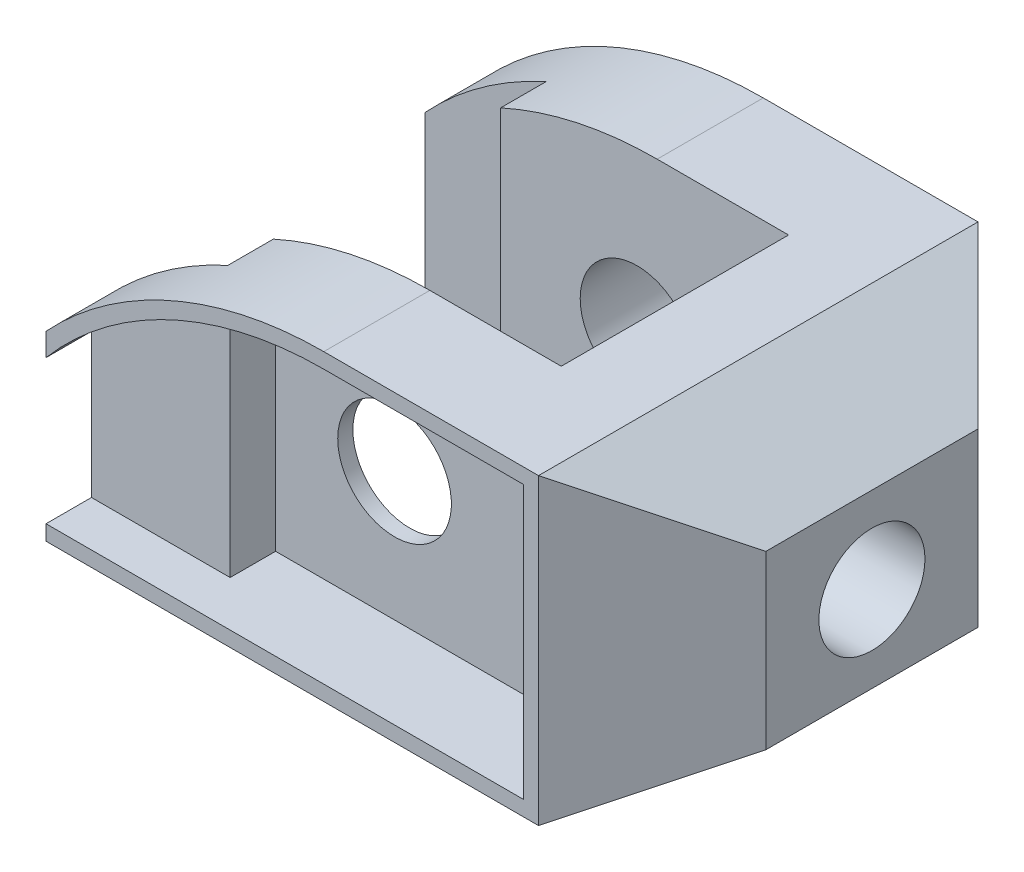
from build123d import *

# Parameters (mm, degrees)
SKETCH1_R           = 7.5
BOSS_EXTRUDE1_DEPTH = 29
CUT_EXTRUDE1_DEPTH  = 72
CUT_EXTRUDE2_DEPTH  = 72
SKETCH4_R           = 7
CUT_EXTRUDE3_DEPTH  = 72
CUT_EXTRUDE11_DEPTH = 12
CUT_EXTRUDE12_DEPTH = 6


with BuildPart() as part:
    # Sketch1 → Boss-Extrude1 (new, symmetric)
    with BuildSketch(Plane.XY):
        with BuildLine():
            Line((0, 0), (65, 0))
            Line((65, 0), (80, 8.660254038))
            Line((80, 8.660254038), (80, 31.339745962))
            Line((80, 31.339745962), (65, 40))
            Line((65, 40), (36.66060556, 40))
            ThreePointArc((36.66060556, 40), (16.66060556, 35.82575695), (0, 24))
            Line((0, 24), (0, 0))
        make_face()
        with Locations(Location((34, 19, 0), (0, 0, 180))):
            Circle(SKETCH1_R, mode=Mode.SUBTRACT)
    extrude(amount=BOSS_EXTRUDE1_DEPTH, both=True)

    # Sketch2 → Cut-Extrude1 (cut)
    with BuildSketch(Plane(origin=(0, 0, 0), x_dir=(1, 0, 0), z_dir=(0, 1, 0))):
        Polygon((0, 21), (16, 21), (16, 15), (54, 15), (54, -15), (16, -15), (16, -21), (0, -21), align=None)
    extrude(amount=CUT_EXTRUDE1_DEPTH, mode=Mode.SUBTRACT)

    # Sketch3 → Cut-Extrude2 (cut)
    with BuildSketch(Plane(origin=(0, 0, 0), x_dir=(1, 0, 0), z_dir=(0, 1, 0))):
        Polygon((80, 29), (65, 29), (80, 14), align=None)
        Polygon((65, -29), (80, -29), (80, -14), align=None)
    extrude(amount=CUT_EXTRUDE2_DEPTH, mode=Mode.SUBTRACT)

    # Sketch4 → Cut-Extrude3 (cut)
    with BuildSketch(Plane(origin=(80, 0, 0), x_dir=(0, 0, -1), z_dir=(1, 0, 0))):
        with Locations((0, 20)):
            Circle(SKETCH4_R)
    extrude(amount=-CUT_EXTRUDE3_DEPTH, mode=Mode.SUBTRACT)

    # Sketch6 → Cut-Extrude11 (cut)
    with BuildSketch(Plane.XY.offset(29)):
        with BuildLine():
            Line((63, 2), (63, 38))
            Line((63, 38), (36.66060556, 38))
            ThreePointArc((36.66060556, 38), (27.30122037, 37.078677858), (18.301127214, 34.350079536))
            Line((18.301127214, 34.350079536), (18.301127214, 2))
            Line((18.301127214, 2), (63, 2))
        make_face()
    extrude(amount=-CUT_EXTRUDE11_DEPTH, mode=Mode.SUBTRACT)

    # Sketch8 → Cut-Extrude12 (cut)
    with BuildSketch(Plane.XY.offset(29)):
        with BuildLine():
            Line((0, 2), (18.301127214, 2))
            Line((18.301127214, 2), (18.301127214, 34.350079536))
            ThreePointArc((18.301127214, 34.350079536), (8.350425073, 28.76252934), (0, 20.98386677))
            Line((0, 20.98386677), (0, 2))
        make_face()
    extrude(amount=-CUT_EXTRUDE12_DEPTH, mode=Mode.SUBTRACT)


solid = part.part
